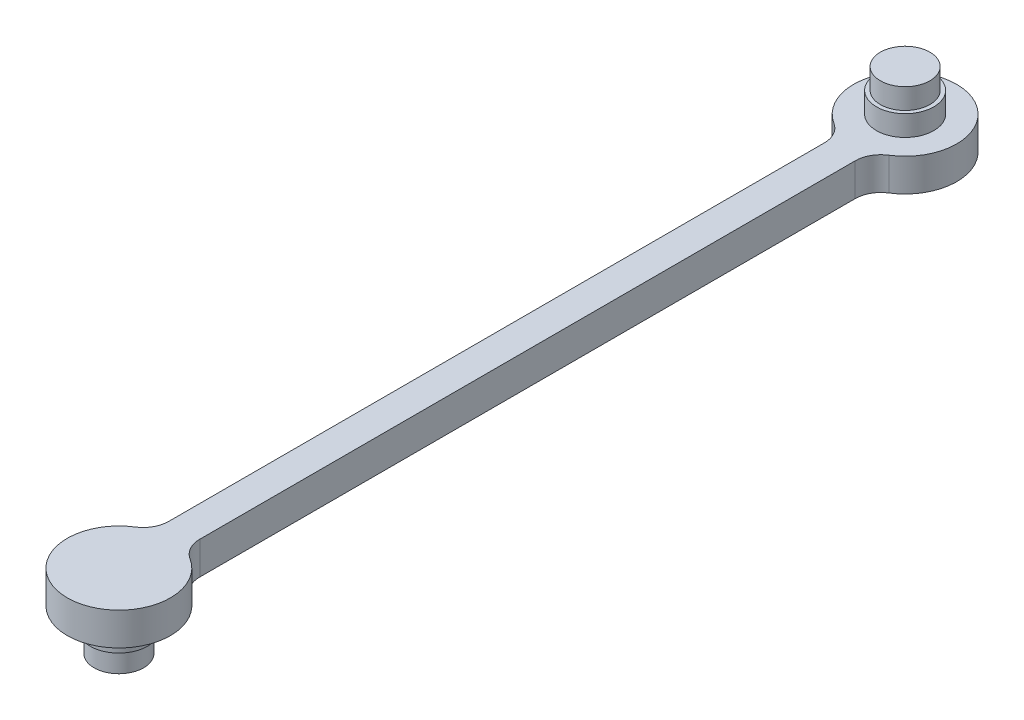
from build123d import *

# Parameters (mm, degrees)
BOSS_EXTRUDE1_DEPTH = 6.35
SKETCH2_R           = 5.55625
BOSS_EXTRUDE2_DEPTH = 4
SKETCH4_R           = 4.805
BOSS_EXTRUDE3_DEPTH = 4
SKETCH5_R           = 5.55625
BOSS_EXTRUDE4_DEPTH = 4
SKETCH6_R           = 4.805
BOSS_EXTRUDE5_DEPTH = 4
FILLET1_R           = 5


with BuildPart() as part:
    # Sketch1 → Boss-Extrude1 (new body)
    with BuildSketch(Plane(origin=(0, 0, 0), x_dir=(1, 0, 0), z_dir=(0, 1, 0))):
        with BuildLine():
            Line((0, 9.539392014), (0, 0))
            Line((0, 0), (6, 0))
            Line((6, 0), (6, 9.539392014))
            ThreePointArc((6, 9.539392014), (3, 10), (0, 9.539392014))
        make_face()
        with BuildLine():
            Line((6, 0), (0, 0))
            Line((0, 0), (0, 9.539392014))
            ThreePointArc((0, 9.539392014), (-2.916079783, -8.062257748), (13, 0))
            ThreePointArc((13, 0), (11.062257748, 5.916079783), (6, 9.539392014))
            Line((6, 9.539392014), (6, 0))
        make_face()
        with BuildLine():
            Line((0, 142.860607986), (0, 9.539392014))
            ThreePointArc((0, 9.539392014), (3, 10), (6, 9.539392014))
            Line((6, 9.539392014), (6, 142.860607986))
            ThreePointArc((6, 142.860607986), (3, 142.4), (0, 142.860607986))
        make_face()
        with BuildLine():
            ThreePointArc((13, 152.4), (-2.916079783, 160.462257748), (0, 142.860607986))
            Line((0, 142.860607986), (0, 152.4))
            Line((0, 152.4), (6, 152.4))
            Line((6, 152.4), (6, 142.860607986))
            ThreePointArc((6, 142.860607986), (11.062257748, 146.483920217), (13, 152.4))
        make_face()
        with BuildLine():
            Line((0, 152.4), (0, 142.860607986))
            ThreePointArc((0, 142.860607986), (3, 142.4), (6, 142.860607986))
            Line((6, 142.860607986), (6, 152.4))
            Line((6, 152.4), (0, 152.4))
        make_face()
    extrude(amount=BOSS_EXTRUDE1_DEPTH)

    # Sketch2 → Boss-Extrude2 (add)
    with BuildSketch(Plane(origin=(0, 6.35, 0), x_dir=(1, 0, 0), z_dir=(0, 1, 0))):
        with Locations(Location((3, 152.4, 0), (0, 0, 270))):
            Circle(SKETCH2_R)
    extrude(amount=BOSS_EXTRUDE2_DEPTH)

    # Sketch4 → Boss-Extrude3 (add)
    with BuildSketch(Plane(origin=(0, 10.35, 0), x_dir=(1, 0, 0), z_dir=(0, 1, 0))):
        with Locations(Location((3, 152.4, 0), (0, 0, 270))):
            Circle(SKETCH4_R)
    extrude(amount=BOSS_EXTRUDE3_DEPTH)

    # Sketch5 → Boss-Extrude4 (add)
    with BuildSketch(Plane.XZ):
        with Locations(Location((3, 0, 0), (0, 0, 270))):
            Circle(SKETCH5_R)
    extrude(amount=BOSS_EXTRUDE4_DEPTH)

    # Sketch6 → Boss-Extrude5 (add)
    with BuildSketch(Plane.XZ.offset(4)):
        with Locations(Location((3, 0, 0), (0, 0, 270))):
            Circle(SKETCH6_R)
    extrude(amount=BOSS_EXTRUDE5_DEPTH)

    # Fillet1
    fillet1_edges = [part.edges().sort_by_distance(p)[0] for p in [
        (0, 3.175, -9.539392014),
        (0, 3.175, -142.860607986),
        (6, 3.175, -142.860607986),
        (6, 3.175, -9.539392014),
    ]]
    fillet(fillet1_edges, radius=FILLET1_R)


solid = part.part
